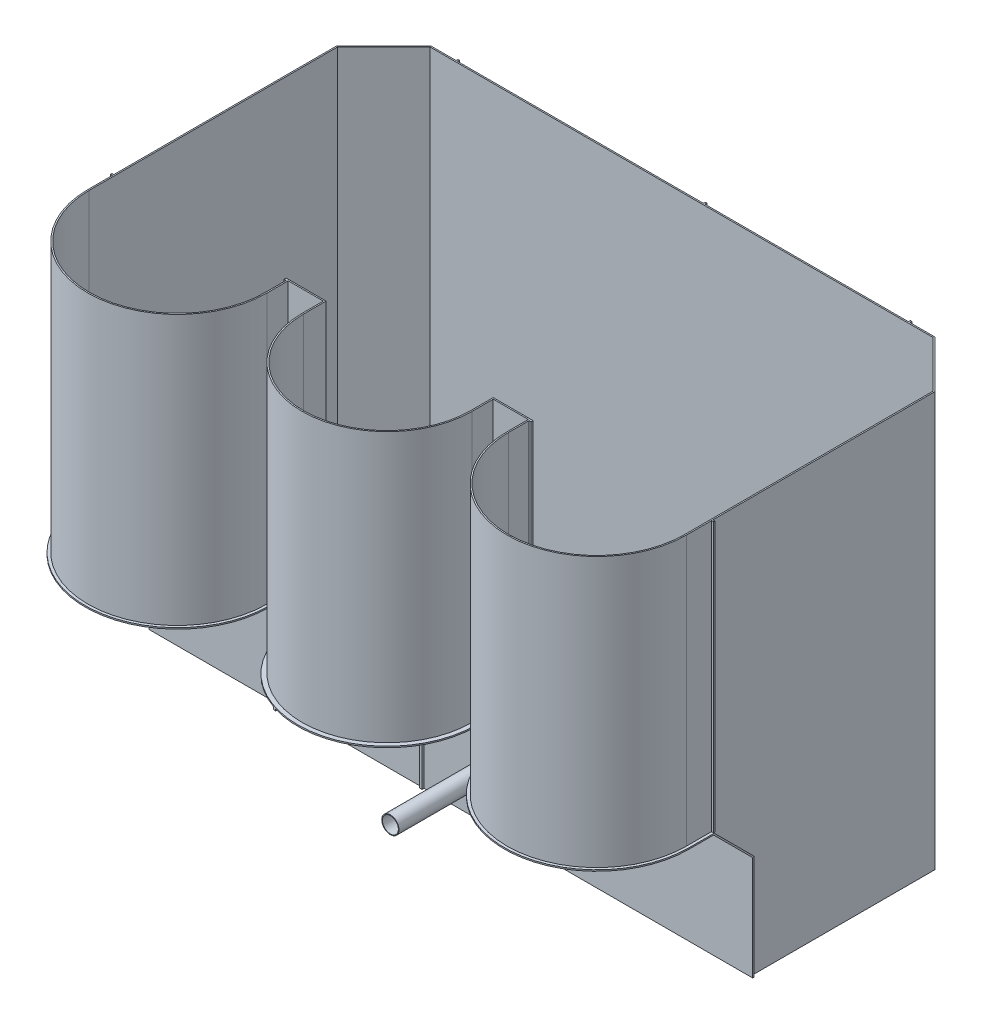
from build123d import *

# Parameters (mm, degrees)
EXTRUDE_THIN1_DEPTH     = 3120
CUT_EXTRUDE1_DEPTH      = 4353.048368297
CUT_EXTRUDE1_DEPTH_BACK = 4353.048368297
BOSS_EXTRUDE2_DEPTH     = 2275
SKETCH6_W               = 20
SKETCH6_H               = 415.979797465
BOSS_EXTRUDE4_DEPTH     = 15
SKETCH5_W               = 20
SKETCH5_H               = 785.857864376
BOSS_EXTRUDE5_DEPTH     = 15
SKETCH7_W               = 20
SKETCH7_H               = 880.857864376
BOSS_EXTRUDE6_DEPTH     = 15
SKETCH8_W               = 15
SKETCH8_H               = 2020
BOSS_EXTRUDE7_DEPTH     = 15
SKETCH9_W               = 15
SKETCH9_H               = 2020
BOSS_EXTRUDE8_DEPTH     = 15
SKETCH10_W              = 10
SKETCH10_H              = 2030
BOSS_EXTRUDE15_DEPTH    = 15
SKETCH11_W              = 10
SKETCH11_H              = 2040
BOSS_EXTRUDE16_DEPTH    = 15
SKETCH12_W              = 10
SKETCH12_H              = 3120
BOSS_EXTRUDE17_DEPTH    = 15
CUT_EXTRUDE2_DEPTH      = 3675.101931085
CUT_EXTRUDE2_DEPTH_BACK = 3675.101931085
SKETCH14_R              = 65
SKETCH14_R_2            = 60
EXTRUDE_THIN2_DEPTH     = 1205


with BuildPart() as part:
    # Sketch1 → Extrude-Thin1 (new body)
    with BuildSketch(Plane(origin=(0, 0, 0), x_dir=(1, 0, 0), z_dir=(0, 1, 0))):
        with BuildLine():
            Line((905, -1355), (905, -1195))
            Line((905, -1195), (640, -1195))
            Line((640, -1195), (640, -1355))
            ThreePointArc((640, -1355), (0, -1995), (-640, -1355))
            Line((-640, -1355), (-640, -1195))
            Line((-640, -1195), (-905, -1195))
            Line((-905, -1195), (-905, -1355))
            ThreePointArc((-905, -1355), (-1580, -2030), (-2255, -1355))
            Line((-2255, -1355), (-2255, 519.142135624))
            Line((-2255, 519.142135624), (-1899.142135624, 875))
            Line((-1899.142135624, 875), (1899.142135624, 875))
            Line((1899.142135624, 875), (2255, 519.142135624))
            Line((2255, 519.142135624), (2255, -1355))
            ThreePointArc((2255, -1355), (1580, -2030), (905, -1355))
        make_face()
        with BuildLine():
            Line((915, -1355), (915, -1185))
            Line((915, -1185), (630, -1185))
            Line((630, -1185), (630, -1355))
            ThreePointArc((630, -1355), (0, -1985), (-630, -1355))
            Line((-630, -1355), (-630, -1185))
            Line((-630, -1185), (-915, -1185))
            Line((-915, -1185), (-915, -1355))
            ThreePointArc((-915, -1355), (-1580, -2020), (-2245, -1355))
            Line((-2245, -1355), (-2245, 515))
            Line((-2245, 515), (-1895, 865))
            Line((-1895, 865), (1895, 865))
            Line((1895, 865), (2245, 515))
            Line((2245, 515), (2245, -1355))
            ThreePointArc((2245, -1355), (1580, -2020), (915, -1355))
        make_face(mode=Mode.SUBTRACT)
    extrude(amount=EXTRUDE_THIN1_DEPTH)

    # Sketch2 → Cut-Extrude1 (cut, two sides: drawn at the far end of the back side and taken through both)
    with BuildSketch(Plane(origin=(0, 0, 0), x_dir=(0, 0, -1), z_dir=(1, 0, 0)).offset(-CUT_EXTRUDE1_DEPTH_BACK)):
        Polygon((-865, 0), (-865, 790), (-1165, 1090), (-2050, 1090), (-2101.676974478, 1090), (-2101.676974478, -15.106412635), (-865, -15.106412635), align=None)
    extrude(amount=CUT_EXTRUDE1_DEPTH + CUT_EXTRUDE1_DEPTH_BACK, mode=Mode.SUBTRACT)

    # Sketch3 → Boss-Extrude2 (add, symmetric)
    with BuildSketch(Plane(origin=(0, 0, 0), x_dir=(0, 0, -1), z_dir=(1, 0, 0))):
        Polygon((-865, 0), (-865, 790), (-1165, 1090), (-2050, 1090), (-2050, 1080), (-1169.142135624, 1080), (-875, 785.857864376), (-875, 0), align=None)
    extrude(amount=BOSS_EXTRUDE2_DEPTH, both=True)

    # Sketch6 → Boss-Extrude4 (add)
    with BuildSketch(Plane(origin=(0, -44.571067812, 44.571067812), x_dir=(1, 0, 0), z_dir=(0, -0.7071067811865475, 0.7071067811865477))):
        with Locations((-210, 1382.39375722)):
            Rectangle(SKETCH6_W, SKETCH6_H)
    extrude(amount=BOSS_EXTRUDE4_DEPTH)

    # Sketch5 → Boss-Extrude5 (add)
    with BuildSketch(Plane.XY.offset(875)):
        with Locations((-210, 392.928932188)):
            Rectangle(SKETCH5_W, SKETCH5_H)
    extrude(amount=BOSS_EXTRUDE5_DEPTH)

    # Sketch7 → Boss-Extrude6 (add)
    with BuildSketch(Plane.XZ.offset(-1080)):
        with Locations((-210, 1609.571067812)):
            Rectangle(SKETCH7_W, SKETCH7_H)
    extrude(amount=BOSS_EXTRUDE6_DEPTH)

    # Sketch11 → Boss-Extrude16 (add)
    with BuildSketch(Plane.ZY.offset(2255)):
        with Locations((1164.142135624, 2100)):
            Rectangle(SKETCH11_W, SKETCH11_H)
    extrude(amount=BOSS_EXTRUDE16_DEPTH)

    # Sketch12 → Boss-Extrude17 (add)
    with BuildSketch(Plane(origin=(0, 0, -875), x_dir=(-1, 0, 0), z_dir=(0, 0, -1))):
        with Locations((-1704.142135624, 1560)):
            Rectangle(SKETCH12_W, SKETCH12_H)
        with Locations((1704.142135624, 1560)):
            Rectangle(SKETCH12_W, SKETCH12_H)
        with Locations((-159.142135624, 1560)):
            Rectangle(SKETCH12_W, SKETCH12_H)
    extrude(amount=BOSS_EXTRUDE17_DEPTH)

    # Sketch13 → Cut-Extrude2 (cut, two sides: drawn at the far end of the back side and taken through both)
    with BuildSketch(Plane(origin=(0, 1090, 0), x_dir=(1, 0, 0), z_dir=(0, 1, 0)).offset(-CUT_EXTRUDE2_DEPTH_BACK)):
        with BuildLine():
            Line((-2275, -1355), (-2439.252961853, -1355))
            Line((-2439.252961853, -1355), (-2439.252961853, -2187.959139027))
            Line((-2439.252961853, -2187.959139027), (2586.364187852, -2187.959139027))
            Line((2586.364187852, -2187.959139027), (2586.364187852, -1355))
            Line((2586.364187852, -1355), (2275, -1355))
            ThreePointArc((2275, -1355), (1580, -2050), (885, -1355))
            Line((885, -1355), (672, -1355))
            ThreePointArc((672, -1355), (0, -2027), (-672, -1355))
            Line((-672, -1355), (-885, -1355))
            ThreePointArc((-885, -1355), (-1580, -2050), (-2275, -1355))
        make_face()
    extrude(amount=CUT_EXTRUDE2_DEPTH + CUT_EXTRUDE2_DEPTH_BACK, mode=Mode.SUBTRACT)

    # Sketch14 → Extrude-Thin2 (add)
    with BuildSketch(Plane.XY.offset(875)):
        with Locations((750, 840)):
            Circle(SKETCH14_R)
        with Locations((750, 840)):
            Circle(SKETCH14_R_2, mode=Mode.SUBTRACT)
    extrude(amount=EXTRUDE_THIN2_DEPTH)


with BuildPart() as body_2:
    # Sketch8 → Boss-Extrude7 (new body)
    with BuildSketch(Plane(origin=(0, 0, 1185), x_dir=(-1, 0, 0), z_dir=(0, 0, -1))):
        with Locations((922.5, 2110)):
            Rectangle(SKETCH8_W, SKETCH8_H)
    extrude(amount=-BOSS_EXTRUDE7_DEPTH)


with BuildPart() as body_3:
    # Sketch9 → Boss-Extrude8 (new body)
    with BuildSketch(Plane(origin=(0, 0, 1185), x_dir=(-1, 0, 0), z_dir=(0, 0, -1))):
        with Locations((-922.5, 2110)):
            Rectangle(SKETCH9_W, SKETCH9_H)
    extrude(amount=-BOSS_EXTRUDE8_DEPTH)


with BuildPart() as body_4:
    # Sketch10 → Boss-Extrude15 (new body)
    with BuildSketch(Plane(origin=(2255, 0, 0), x_dir=(0, 0, -1), z_dir=(1, 0, 0))):
        with Locations((-1160, 2105)):
            Rectangle(SKETCH10_W, SKETCH10_H)
    extrude(amount=BOSS_EXTRUDE15_DEPTH)


solid = Compound([part.part, body_2.part, body_3.part, body_4.part])
